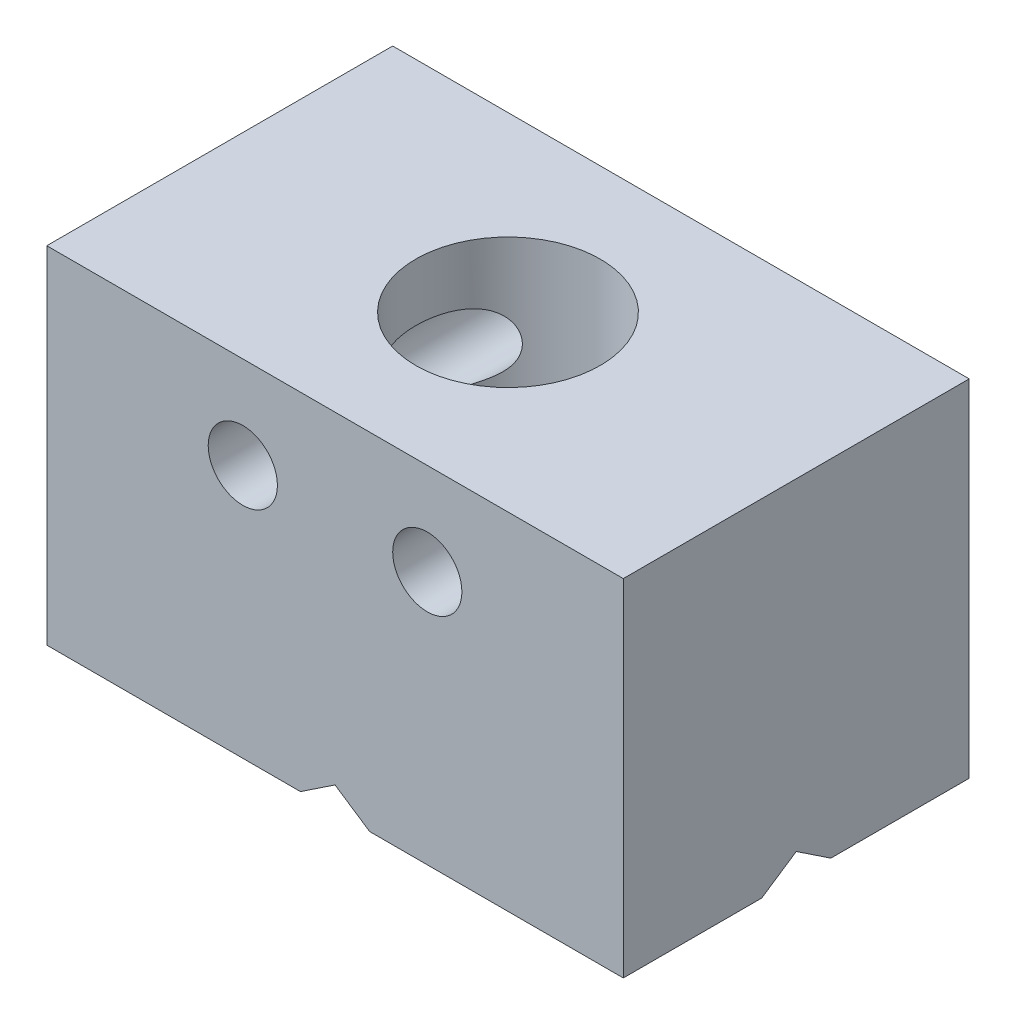
from build123d import *

# Parameters (mm, degrees)
SKETCH1_W                 = 25
SKETCH1_H                 = 15
BOSS_EXTRUDE1_DEPTH       = 15
F_3_0MM_DOWEL_HOLE1_D     = 3
CUT_EXTRUDE1_DEPTH        = 15
CUT_EXTRUDE2_DEPTH        = 49
F_8_0MM_DOWEL_HOLE1_D     = 8
F_8_0MM_DOWEL_HOLE1_DEPTH = 9
F_8_0MM_DOWEL_HOLE1_TIP   = 2.403442476


with BuildPart() as part:
    # Sketch1 → Boss-Extrude1 (new body)
    with BuildSketch(Plane.XY):
        Rectangle(SKETCH1_W, SKETCH1_H)
    extrude(amount=BOSS_EXTRUDE1_DEPTH)

    # Ø3.0mm Dowel Hole1 (through all)
    with Locations(Plane(origin=(0, 0, 0), x_dir=(-1, 0, 0), z_dir=(0, 0, -1))):
        with Locations((4, 3.5), (-4, 3.5)):
            Hole(F_3_0MM_DOWEL_HOLE1_D / 2)

    # Sketch4 → Cut-Extrude1 (cut)
    with BuildSketch(Plane(origin=(0, 0, 0), x_dir=(-1, 0, 0), z_dir=(0, 0, -1))):
        Polygon((-1.5, -7.5), (0, -6.5), (1.5, -7.5), (1.5, -8.661877418), (-1.5, -8.661877418), align=None)
    extrude(amount=-CUT_EXTRUDE1_DEPTH, mode=Mode.SUBTRACT)

    # Sketch5 → Cut-Extrude2 (cut)
    with BuildSketch(Plane.ZY.offset(12.5)):
        Polygon((6, -7.5), (7.5, -6.5), (9, -7.5), (9, -8.497485746), (6.14045431, -8.497485746), align=None)
    extrude(amount=-CUT_EXTRUDE2_DEPTH, mode=Mode.SUBTRACT)

    # Ø8.0mm Dowel Hole1
    with Locations(Plane(origin=(0, 7.5, 0), x_dir=(1, 0, 0), z_dir=(0, 1, 0))):
        with Locations((0, -7.5)):
            Hole(F_8_0MM_DOWEL_HOLE1_D / 2, depth=F_8_0MM_DOWEL_HOLE1_DEPTH)
            with Locations((0, 0, -(F_8_0MM_DOWEL_HOLE1_DEPTH + F_8_0MM_DOWEL_HOLE1_TIP / 2))):  # 118° drill point
                Cone(0, F_8_0MM_DOWEL_HOLE1_D / 2, F_8_0MM_DOWEL_HOLE1_TIP, mode=Mode.SUBTRACT)


solid = part.part
